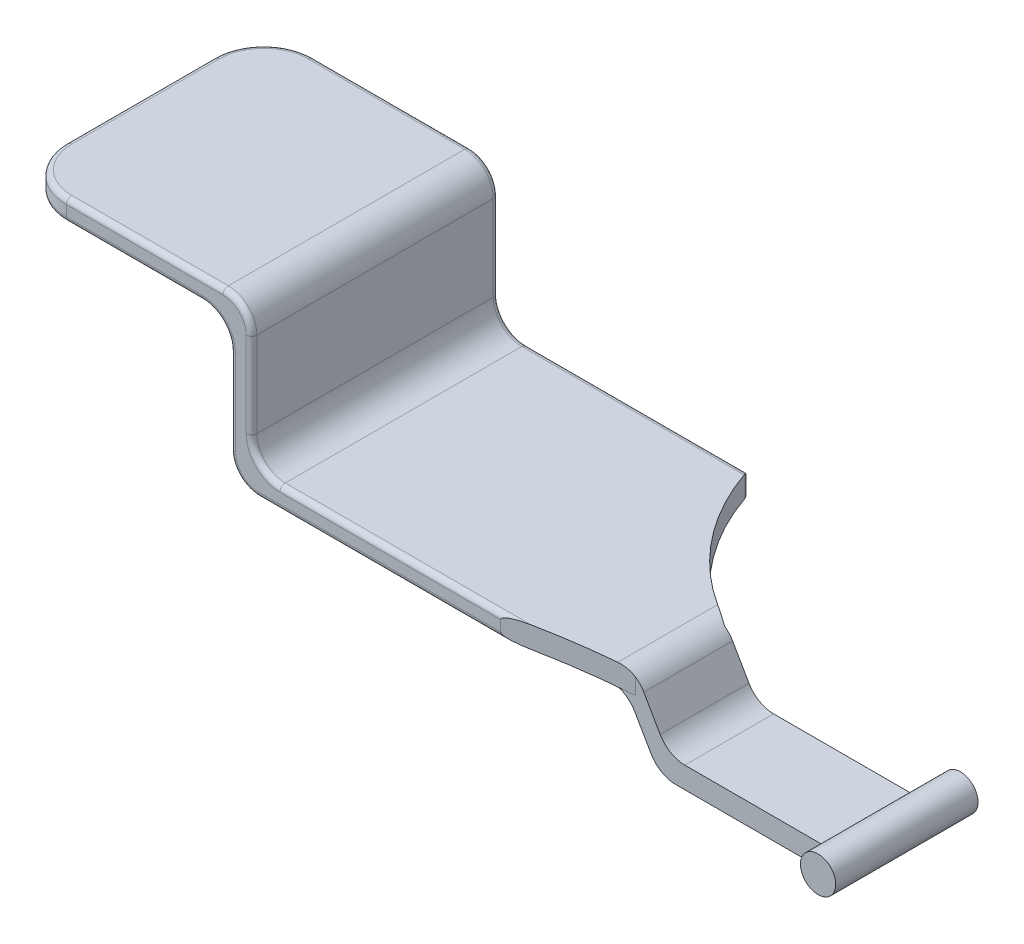
from build123d import *

# Parameters (mm, degrees)
SKETCH2_R            = 2.48
BOSS_EXTRUDE1_DEPTH  = 20
SKETCH3_W            = 24.73
SKETCH3_H            = 12.48
BOSS_EXTRUDE3_DEPTH  = 1.5
BOSS_EXTRUDE7_DEPTH  = 12.48
BOSS_EXTRUDE9_DEPTH  = 3
SKETCH9_W            = 10
SKETCH9_H            = 3
BOSS_EXTRUDE10_DEPTH = 34.71
SKETCH10_W           = 3
SKETCH10_H           = 23
BOSS_EXTRUDE11_DEPTH = 34.71
SKETCH11_W           = 34.71
SKETCH11_H           = 3
BOSS_EXTRUDE12_DEPTH = 30
FILLET1_R            = 4
FILLET3_R            = 7
FILLET4_R            = 0.75


with BuildPart() as part:
    # Sketch2 → Boss-Extrude1 (new body)
    with BuildSketch(Plane.XY):
        Circle(SKETCH2_R)
    extrude(amount=BOSS_EXTRUDE1_DEPTH)

    # Sketch3 → Boss-Extrude3 (add, symmetric)
    with BuildSketch(Plane(origin=(0, 0, 0), x_dir=(1, 0, 0), z_dir=(0, 1, 0))):
        with Locations((12.365, -11.34)):
            Rectangle(SKETCH3_W, SKETCH3_H)
    extrude(amount=BOSS_EXTRUDE3_DEPTH, both=True)

    # Sketch7 → Boss-Extrude7 (add)
    with BuildSketch(Plane.XY.offset(5.1)):
        Polygon((21.73, -1.5), (24.73, -1.5), (31.062035578, 9.5), (28.062035578, 9.5), align=None)
    extrude(amount=BOSS_EXTRUDE7_DEPTH)

    # Sketch8 → Boss-Extrude9 (add)
    with BuildSketch(Plane(origin=(0, 9.5, 0), x_dir=(1, 0, 0), z_dir=(0, 1, 0))):
        with BuildLine():
            Line((72.552035578, -20.06), (44.552035578, -20.06))
            ThreePointArc((44.552035578, -20.06), (36.356523667, -18.490944118), (28.062035578, -17.58))
            Line((28.062035578, -17.58), (28.062035578, -5.1))
            ThreePointArc((28.062035578, -5.1), (38.220194009, 3.177633796), (44.552035578, 14.65))
            Line((44.552035578, 14.65), (72.552035578, 14.65))
            Line((72.552035578, 14.65), (72.552035578, -20.06))
        make_face()
    extrude(amount=-BOSS_EXTRUDE9_DEPTH)

    # Sketch9 → Boss-Extrude10 (add)
    with BuildSketch(Plane.XY.offset(20.06)):
        with Locations((77.552035578, 8)):
            Rectangle(SKETCH9_W, SKETCH9_H)
    extrude(amount=-BOSS_EXTRUDE10_DEPTH)

    # Sketch10 → Boss-Extrude11 (add)
    with BuildSketch(Plane.XY.offset(20.06)):
        with Locations((81.052035578, 18)):
            Rectangle(SKETCH10_W, SKETCH10_H)
    extrude(amount=-BOSS_EXTRUDE11_DEPTH)

    # Sketch11 → Boss-Extrude12 (add)
    with BuildSketch(Plane(origin=(82.552035578, 0, 0), x_dir=(0, 0, -1), z_dir=(1, 0, 0))):
        with Locations((-2.705, 28)):
            Rectangle(SKETCH11_W, SKETCH11_H)
    extrude(amount=BOSS_EXTRUDE12_DEPTH)

    # Fillet1
    fillet1_edges = [part.edges().sort_by_distance(p)[0] for p in [
        (24.73, -1.5, 11.34),
        (82.552035578, 26.5, 2.705),
        (23.456918794, 1.5, 11.34),
        (28.062035578, 9.5, 11.34),
        (29.335116784, 6.5, 11.34),
        (82.552035578, 6.5, 2.705),
        (79.552035578, 9.5, 2.705),
        (79.552035578, 29.5, 2.705),
    ]]
    fillet(fillet1_edges, radius=FILLET1_R)

    # Fillet3
    fillet3_edges = [part.edges().sort_by_distance(p)[0] for p in [
        (112.552035578, 28, 20.06),
        (112.552035578, 28, -14.65),
    ]]
    fillet(fillet3_edges, radius=FILLET3_R)

    # Fillet4
    fillet4_edges = [part.edges().sort_by_distance(p)[0] for p in [
        (60.052035578, 9.5, -14.65),
        (61.552035578, 6.5, -14.65),
        (82.552035578, 16.5, 20.06),
        (79.552035578, 19.5, 20.06),
        (80.723608453, 28.328427125, 20.06),
        (81.380462702, 7.671572875, 20.06),
        (82.552035578, 16.5, -14.65),
        (79.552035578, 19.5, -14.65),
        (80.723608453, 28.328427125, -14.65),
        (81.380462702, 7.671572875, -14.65),
        (78.380462702, 10.671572875, -14.65),
        (78.380462702, 10.671572875, 20.06),
        (83.723608453, 25.328427125, -14.65),
        (83.723608453, 25.328427125, 20.06),
        (112.552035578, 26.5, 2.705),
        (112.552035578, 29.5, 2.705),
        (96.052035578, 26.5, 20.06),
        (96.052035578, 26.5, -14.65),
        (110.501783046, 26.5, -12.599747468),
        (110.501783046, 26.5, 18.009747468),
        (94.552035578, 29.5, 20.06),
        (94.552035578, 29.5, -14.65),
        (110.501783046, 29.5, -12.599747468),
        (110.501783046, 29.5, 18.009747468),
        (60.052035578, 9.5, 20.06),
        (44.552035578, 8, -14.65),
        (61.552035578, 6.5, 20.06),
    ]]
    fillet(fillet4_edges, radius=FILLET4_R)


with BuildPart() as body_2:
    # Mirror5: mirrored copy
    add(part.part.mirror(Plane(origin=(119.85106591, 0, 0), x_dir=(0, 0, 1), z_dir=(1, 0, 0))))


solid = body_2.part
